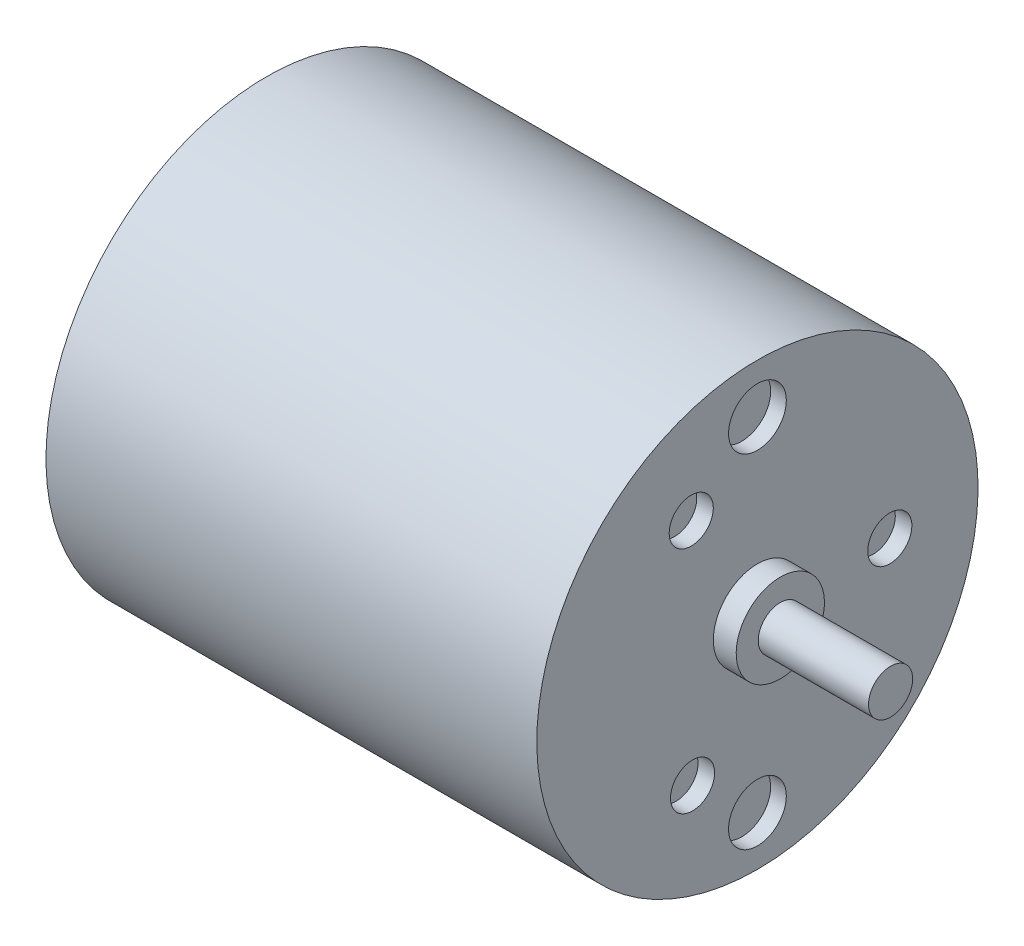
from build123d import *

# Parameters (mm, degrees)
SKETCH1_W          = 10.5
SKETCH1_H          = 20
SKETCH1_W_2        = 73.726566952
SKETCH1_H_2        = 40
SKETCH1_W_3        = 20
SKETCH1_H_3        = 4
SKETCH4_R          = 5.236569571
CUT_EXTRUDE3_DEPTH = 3
SKETCH7_R          = 4
CUT_EXTRUDE4_DEPTH = 3


with BuildPart() as part:
    # Sketch1 → Revolve2 (revolve)
    with BuildSketch(Plane.XY, mode=Mode.PRIVATE) as revolve2_sk:
        with Locations((-79.413135593, 19.219422603)):
            Rectangle(SKETCH1_W, SKETCH1_H)
        Polygon((-66.795719354, 49.219422603), (-74.163135593, 49.219422603), (-74.163135593, 29.219422603), (-74.163135593, 9.219422603), (-66.795719354, 9.219422603), align=None)
        with Locations((-29.932435878, 29.219422603)):
            Rectangle(SKETCH1_W_2, SKETCH1_H_2)
        Polygon((14.836864407, 49.219422603), (6.930847598, 49.219422603), (6.930847598, 9.219422603), (14.836864407, 9.219422603), (14.836864407, 17.219422603), align=None)
        Polygon((18.985169492, 17.219422603), (14.836864407, 17.219422603), (14.836864407, 9.219422603), (18.985169492, 9.219422603), (18.985169492, 13.219422603), align=None)
        with Locations((28.985169492, 11.219422603)):
            Rectangle(SKETCH1_W_3, SKETCH1_H_3)
    revolve(revolve2_sk.sketch.rotate(Axis((-107.444319021, 9.219422603, 0), (1, 0, 0)), 180), axis=Axis((-107.444319021, 9.219422603, 0), (1, 0, 0)))

    # Sketch4 → Cut-Extrude3 (cut)
    with BuildSketch(Plane(origin=(15, 0, 0), x_dir=(0, 0, -1), z_dir=(1, 0, 0))):
        with Locations((0, 40.278768816)):
            Circle(SKETCH4_R)
        with Locations(Location((0, -21.839923611, 0), (0, 0, 90))):
            Circle(SKETCH4_R)
    extrude(amount=-CUT_EXTRUDE3_DEPTH, mode=Mode.SUBTRACT)

    # Sketch7 → Cut-Extrude4 (cut)
    with BuildSketch(Plane(origin=(14.836864407, 0, 0), x_dir=(0, 0, -1), z_dir=(1, 0, 0))):
        with Locations(Location((-11.762505522, -11.700507222, 0), (0, 0, 90))):
            Circle(SKETCH7_R)
        with Locations(Location((-12, 30.004032293, 0), (0, 0, 90))):
            Circle(SKETCH7_R)
        with Locations(Location((24, 9.219422603, 0), (0, 0, 90))):
            Circle(SKETCH7_R)
    extrude(amount=-CUT_EXTRUDE4_DEPTH, mode=Mode.SUBTRACT)


solid = part.part
